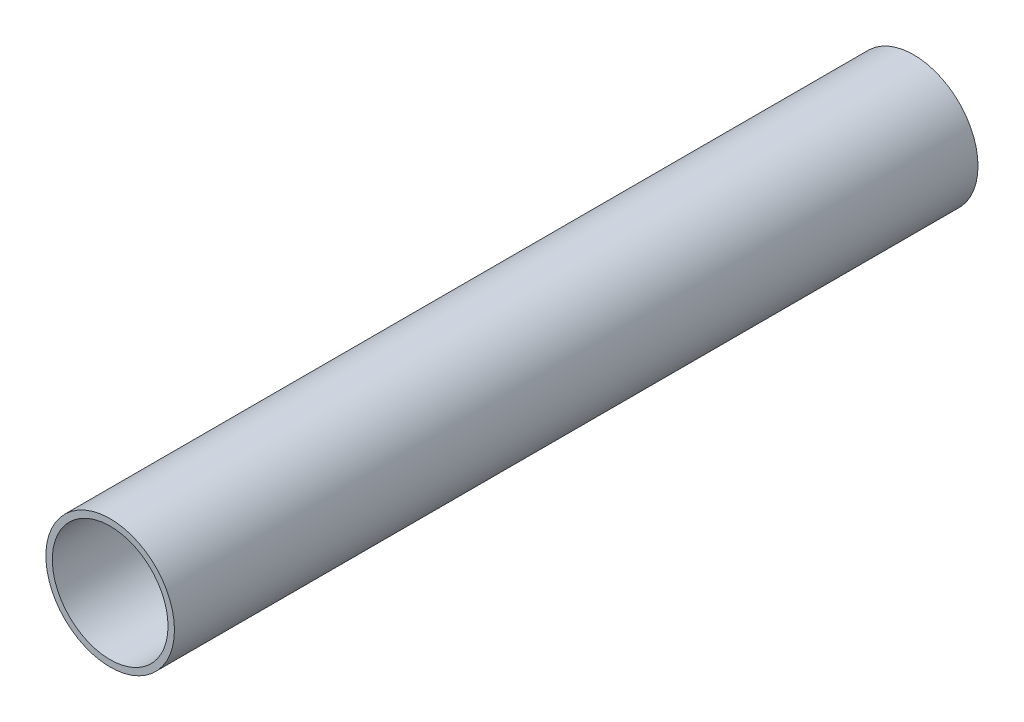
from build123d import *

# Parameters (mm, degrees)
SKETCH1_R           = 20
SKETCH1_R_2         = 18
BOSS_EXTRUDE1_DEPTH = 250


with BuildPart() as part:
    # Sketch1 → Boss-Extrude1 (new body)
    with BuildSketch(Plane.XY):
        Circle(SKETCH1_R)
        Circle(SKETCH1_R_2, mode=Mode.SUBTRACT)
    extrude(amount=BOSS_EXTRUDE1_DEPTH)


solid = part.part
